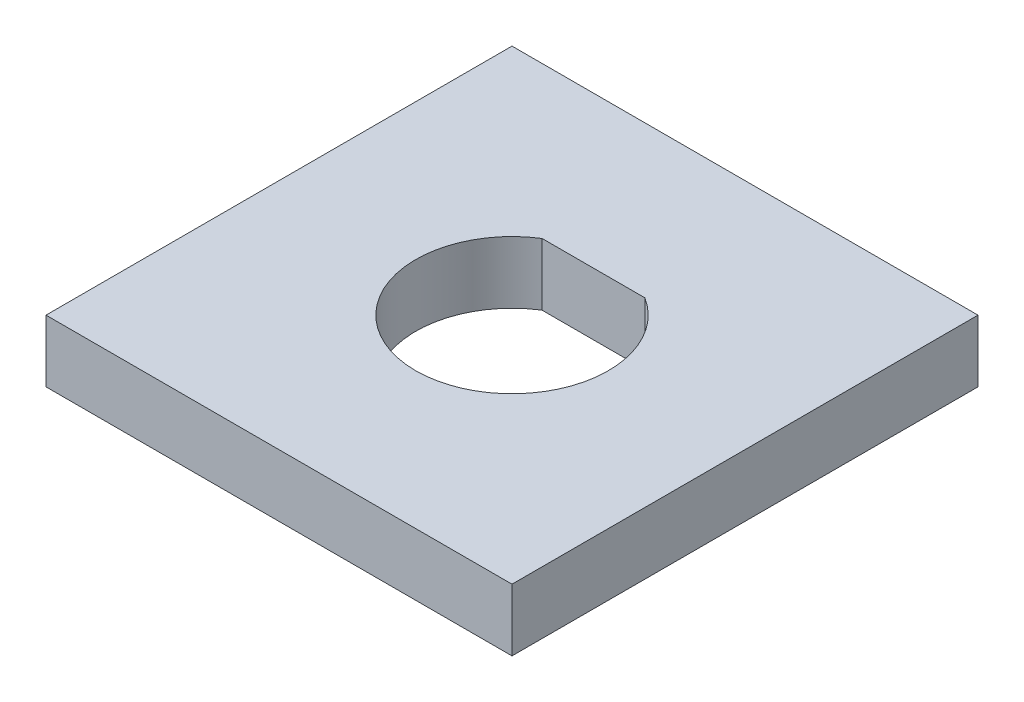
from build123d import *

# Parameters (mm, degrees)
SKETCH1_W           = 15
SKETCH1_H           = 15
BOSS_EXTRUDE1_DEPTH = 2


with BuildPart() as part:
    # Sketch1 → Boss-Extrude1 (new body)
    with BuildSketch(Plane(origin=(0, 0, 0), x_dir=(1, 0, 0), z_dir=(0, 1, 0))):
        Rectangle(SKETCH1_W, SKETCH1_H)
        with BuildLine():
            Line((-1.655, 2.621254471), (1.655, 2.621254471))
            ThreePointArc((1.655, 2.621254471), (0, -3.1), (-1.655, 2.621254471))
        make_face(mode=Mode.SUBTRACT)
    extrude(amount=BOSS_EXTRUDE1_DEPTH)


solid = part.part
